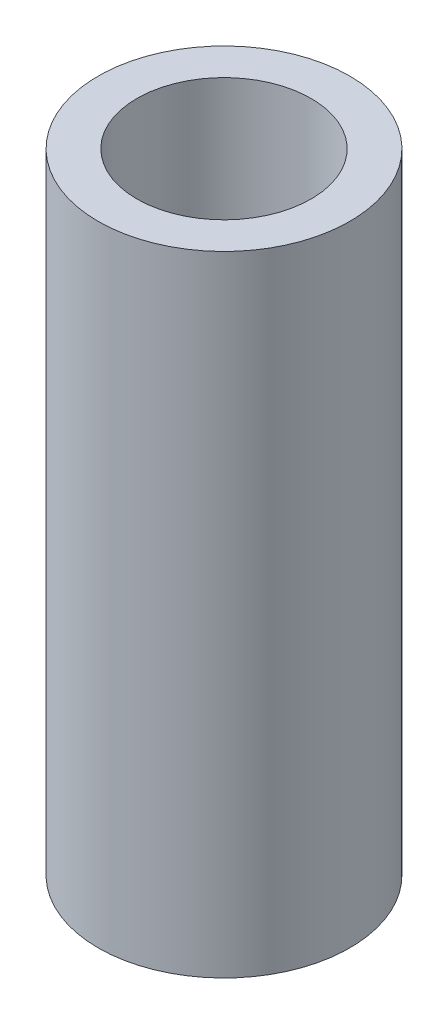
from build123d import *

# Parameters (mm, degrees)
CROQUIS1_R              = 6.5
CROQUIS1_R_2            = 4.5
SALIENTE_EXTRUIR1_DEPTH = 32.5


with BuildPart() as part:
    # Croquis1 → Saliente-Extruir1 (new body)
    with BuildSketch(Plane(origin=(0, 0, 0), x_dir=(1, 0, 0), z_dir=(0, 1, 0))):
        with Locations(Location((0, 0, 0), (0, 0, 270))):
            Circle(CROQUIS1_R)
        with Locations(Location((0, 0, 0), (0, 0, 270))):
            Circle(CROQUIS1_R_2, mode=Mode.SUBTRACT)
    extrude(amount=SALIENTE_EXTRUIR1_DEPTH)


solid = part.part
